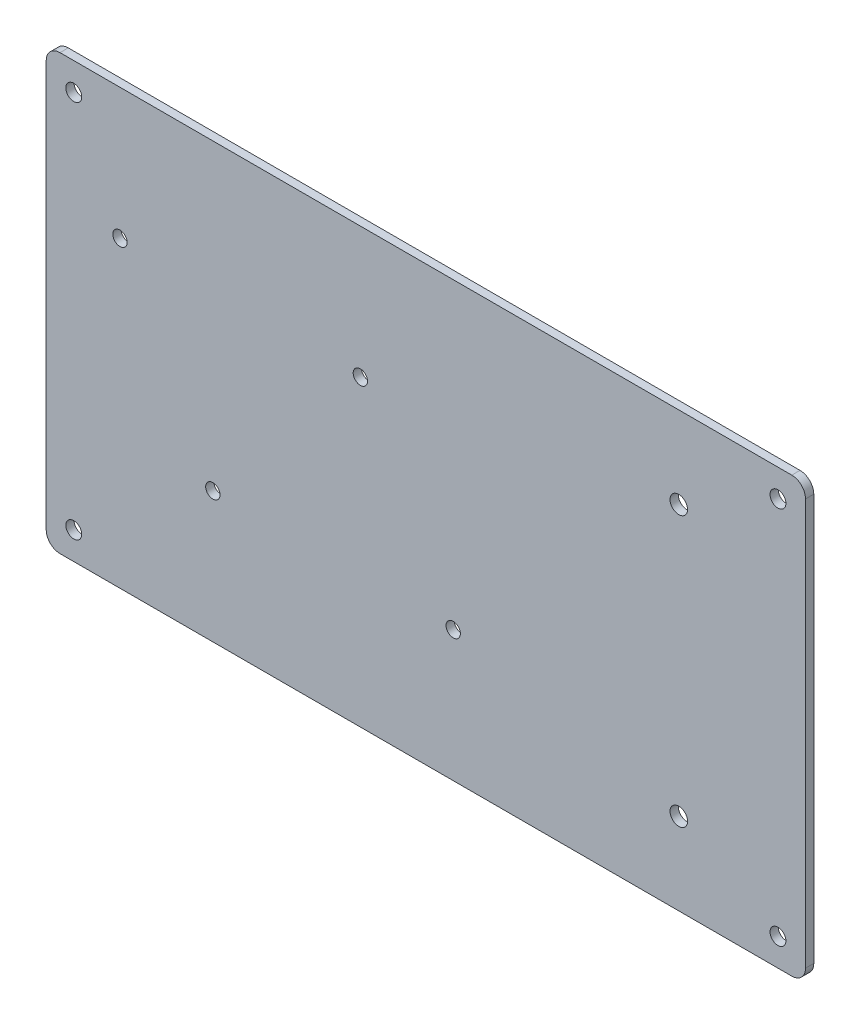
from build123d import *

# Parameters (mm, degrees)
SKETCH1_W                      = 175
SKETCH1_H                      = 100
BOSS_EXTRUDE1_DEPTH            = 1.9
CUT_EXTRUDE1_REACH             = 102.796
SKETCH2_R                      = 1.8288
CUT_EXTRUDE1_DIRECTION_2_DEPTH = 101.796130878
FILLET1_R                      = 3.175
CUT_EXTRUDE2_REACH             = 102.796
SKETCH3_R                      = 1.65
SKETCH3_R_2                    = 2.0193


with BuildPart() as part:
    # Sketch1 → Boss-Extrude1 (new body)
    with BuildSketch(Plane.XY):
        Rectangle(SKETCH1_W, SKETCH1_H)
    extrude(amount=BOSS_EXTRUDE1_DEPTH)

    # Sketch2 → Cut-Extrude1 (cut, up to next)
    with BuildSketch(Plane(origin=(0, 0, 0), x_dir=(-1, 0, 0), z_dir=(0, 0, -1)), mode=Mode.PRIVATE) as cut_extrude1_sk1:
        with Locations(Location((-81.15, 43.65, 0), (0, 0, 180))):
            Circle(SKETCH2_R)
    cut_extrude1_tool1 = extrude(cut_extrude1_sk1.sketch, amount=-CUT_EXTRUDE1_REACH, mode=Mode.PRIVATE) & part.part
    # Sketch2 → Cut-Extrude1 (cut, up to next)
    with BuildSketch(Plane(origin=(0, 0, 0), x_dir=(-1, 0, 0), z_dir=(0, 0, -1)), mode=Mode.PRIVATE) as cut_extrude1_sk2:
        with Locations(Location((-81.15, -43.65, 0), (0, 0, 180))):
            Circle(SKETCH2_R)
    cut_extrude1_tool2 = extrude(cut_extrude1_sk2.sketch, amount=-CUT_EXTRUDE1_REACH, mode=Mode.PRIVATE) & part.part
    # Sketch2 → Cut-Extrude1 (cut, up to next)
    with BuildSketch(Plane(origin=(0, 0, 0), x_dir=(-1, 0, 0), z_dir=(0, 0, -1)), mode=Mode.PRIVATE) as cut_extrude1_sk3:
        with Locations(Location((81.15, 43.65, 0), (0, 0, 180))):
            Circle(SKETCH2_R)
    cut_extrude1_tool3 = extrude(cut_extrude1_sk3.sketch, amount=-CUT_EXTRUDE1_REACH, mode=Mode.PRIVATE) & part.part
    # Sketch2 → Cut-Extrude1 (cut, up to next)
    with BuildSketch(Plane(origin=(0, 0, 0), x_dir=(-1, 0, 0), z_dir=(0, 0, -1)), mode=Mode.PRIVATE) as cut_extrude1_sk4:
        with Locations(Location((81.15, -43.65, 0), (0, 0, 180))):
            Circle(SKETCH2_R)
    cut_extrude1_tool4 = extrude(cut_extrude1_sk4.sketch, amount=-CUT_EXTRUDE1_REACH, mode=Mode.PRIVATE) & part.part
    add(cut_extrude1_tool1.solids().sort_by_distance((81.15, 43.65, 0))[0], mode=Mode.SUBTRACT)
    add(cut_extrude1_tool2.solids().sort_by_distance((81.15, -43.65, 0))[0], mode=Mode.SUBTRACT)
    add(cut_extrude1_tool3.solids().sort_by_distance((-81.15, 43.65, 0))[0], mode=Mode.SUBTRACT)
    add(cut_extrude1_tool4.solids().sort_by_distance((-81.15, -43.65, 0))[0], mode=Mode.SUBTRACT)

    # Sketch2 → Cut-Extrude1 direction 2 (cut)
    with BuildSketch(Plane(origin=(0, 0, 0), x_dir=(-1, 0, 0), z_dir=(0, 0, -1))):
        with Locations(Location((-81.15, 43.65, 0), (0, 0, 180))):
            Circle(SKETCH2_R)
        with Locations(Location((-81.15, -43.65, 0), (0, 0, 180))):
            Circle(SKETCH2_R)
        with Locations(Location((81.15, 43.65, 0), (0, 0, 180))):
            Circle(SKETCH2_R)
        with Locations(Location((81.15, -43.65, 0), (0, 0, 180))):
            Circle(SKETCH2_R)
    extrude(amount=CUT_EXTRUDE1_DIRECTION_2_DEPTH, mode=Mode.SUBTRACT)

    # Fillet1
    fillet1_edges = [part.edges().sort_by_distance(p)[0] for p in [
        (87.5, -50, 0.95),
        (-87.5, -50, 0.95),
        (-87.5, 50, 0.95),
        (87.5, 50, 0.95),
    ]]
    fillet(fillet1_edges, radius=FILLET1_R)

    # Sketch3 → Cut-Extrude2 (cut, up to next)
    with BuildSketch(Plane.XY.offset(1.9), mode=Mode.PRIVATE) as cut_extrude2_sk1:
        with Locations((-49.1, -19.85)):
            Circle(SKETCH3_R)
    cut_extrude2_tool1 = extrude(cut_extrude2_sk1.sketch, amount=-CUT_EXTRUDE2_REACH, mode=Mode.PRIVATE) & part.part
    # Sketch3 → Cut-Extrude2 (cut, up to next)
    with BuildSketch(Plane.XY.offset(1.9), mode=Mode.PRIVATE) as cut_extrude2_sk2:
        with Locations((-70.5, 19.85)):
            Circle(SKETCH3_R)
    cut_extrude2_tool2 = extrude(cut_extrude2_sk2.sketch, amount=-CUT_EXTRUDE2_REACH, mode=Mode.PRIVATE) & part.part
    # Sketch3 → Cut-Extrude2 (cut, up to next)
    with BuildSketch(Plane.XY.offset(1.9), mode=Mode.PRIVATE) as cut_extrude2_sk3:
        with Locations((6.3, -19.85)):
            Circle(SKETCH3_R)
    cut_extrude2_tool3 = extrude(cut_extrude2_sk3.sketch, amount=-CUT_EXTRUDE2_REACH, mode=Mode.PRIVATE) & part.part
    # Sketch3 → Cut-Extrude2 (cut, up to next)
    with BuildSketch(Plane.XY.offset(1.9), mode=Mode.PRIVATE) as cut_extrude2_sk4:
        with Locations((-15.1, 19.85)):
            Circle(SKETCH3_R)
    cut_extrude2_tool4 = extrude(cut_extrude2_sk4.sketch, amount=-CUT_EXTRUDE2_REACH, mode=Mode.PRIVATE) & part.part
    # Sketch3 → Cut-Extrude2 (cut, up to next)
    with BuildSketch(Plane.XY.offset(1.9), mode=Mode.PRIVATE) as cut_extrude2_sk5:
        with Locations((58.29, -31.115)):
            Circle(SKETCH3_R_2)
    cut_extrude2_tool5 = extrude(cut_extrude2_sk5.sketch, amount=-CUT_EXTRUDE2_REACH, mode=Mode.PRIVATE) & part.part
    # Sketch3 → Cut-Extrude2 (cut, up to next)
    with BuildSketch(Plane.XY.offset(1.9), mode=Mode.PRIVATE) as cut_extrude2_sk6:
        with Locations((58.29, 31.115)):
            Circle(SKETCH3_R_2)
    cut_extrude2_tool6 = extrude(cut_extrude2_sk6.sketch, amount=-CUT_EXTRUDE2_REACH, mode=Mode.PRIVATE) & part.part
    add(cut_extrude2_tool1.solids().sort_by_distance((-49.1, -19.85, 1.9))[0], mode=Mode.SUBTRACT)
    add(cut_extrude2_tool2.solids().sort_by_distance((-70.5, 19.85, 1.9))[0], mode=Mode.SUBTRACT)
    add(cut_extrude2_tool3.solids().sort_by_distance((6.3, -19.85, 1.9))[0], mode=Mode.SUBTRACT)
    add(cut_extrude2_tool4.solids().sort_by_distance((-15.1, 19.85, 1.9))[0], mode=Mode.SUBTRACT)
    add(cut_extrude2_tool5.solids().sort_by_distance((58.29, -31.115, 1.9))[0], mode=Mode.SUBTRACT)
    add(cut_extrude2_tool6.solids().sort_by_distance((58.29, 31.115, 1.9))[0], mode=Mode.SUBTRACT)


solid = part.part
